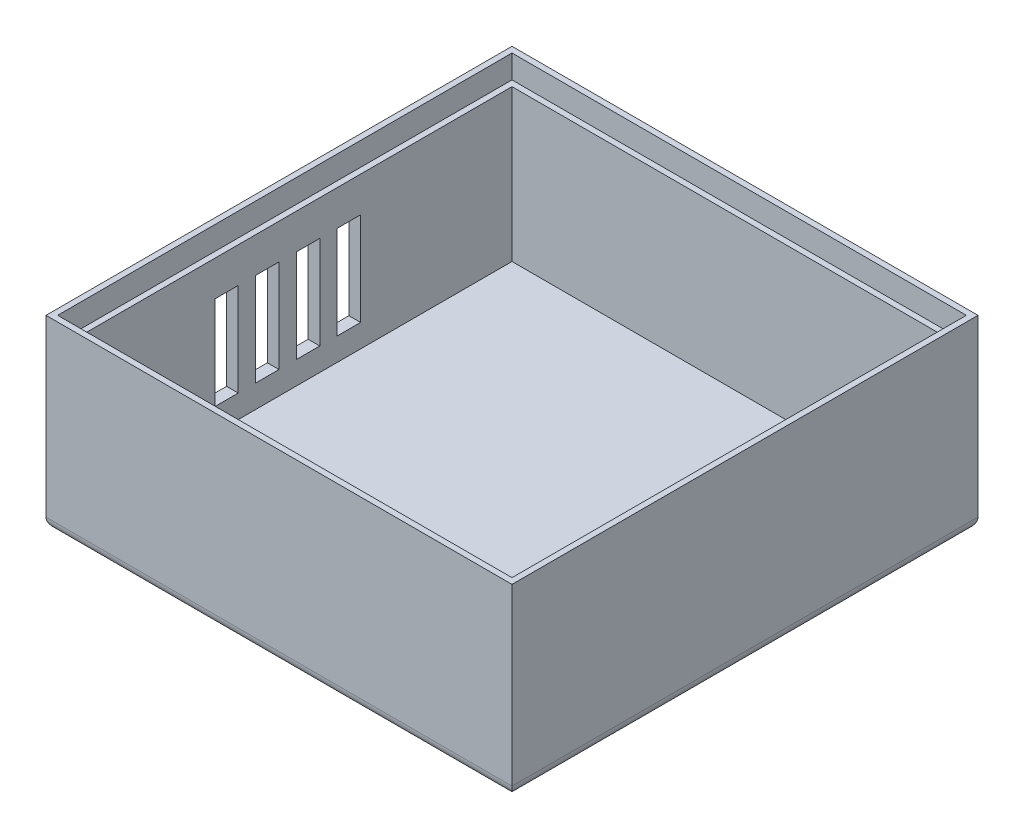
from build123d import *

# Parameters (mm, degrees)
SKETCH_1_W          = 40
SKETCH_1_H          = 40
EXTRUDE_1_DEPTH     = 16
SKETCH_2_W          = 38
SKETCH_2_H          = 38
CUT_EXTRUDE_2_DEPTH = 15
FILLET_2_R          = 1
SKETCH_5_W          = 38
SKETCH_5_H          = 2
CUT_EXTRUDE_4_DEPTH = 0.5
SKETCH_6_W          = 38.5
SKETCH_6_H          = 2
CUT_EXTRUDE_5_DEPTH = 0.5
SKETCH_7_W          = 38.5
SKETCH_7_H          = 2
CUT_EXTRUDE_6_DEPTH = 0.5
SKETCH_8_W          = 39
SKETCH_8_H          = 2
CUT_EXTRUDE_7_DEPTH = 0.5
SKETCH_9_W          = 2
SKETCH_9_H          = 8
CUT_EXTRUDE_9_DEPTH = 10


with BuildPart() as part:
    # Эскиз1 → Бобышка-Вытянуть1 (new body)
    with BuildSketch(Plane(origin=(0, 0, 0), x_dir=(1, 0, 0), z_dir=(0, 1, 0))):
        with Locations((18.915, -19.461)):
            Rectangle(SKETCH_1_W, SKETCH_1_H)
    extrude(amount=EXTRUDE_1_DEPTH)

    # Эскиз2 → Вырез-Вытянуть2 (cut)
    with BuildSketch(Plane(origin=(0, 16, 0), x_dir=(1, 0, 0), z_dir=(0, 1, 0))):
        with Locations((18.915, -19.461)):
            Rectangle(SKETCH_2_W, SKETCH_2_H)
    extrude(amount=-CUT_EXTRUDE_2_DEPTH, mode=Mode.SUBTRACT)

    # Скругление2
    fillet_2_edges = [part.edges().sort_by_distance(p)[0] for p in [
        (18.915, 0, -0.539),
        (38.915, 0, 19.461),
        (18.915, 0, 39.461),
        (-1.085, 0, 19.461),
    ]]
    fillet(fillet_2_edges, radius=FILLET_2_R)

    # Эскиз5 → Вырез-Вытянуть4 (cut)
    with BuildSketch(Plane(origin=(0, 0, 38.461), x_dir=(-1, 0, 0), z_dir=(0, 0, -1))):
        with Locations((-18.915, 15)):
            Rectangle(SKETCH_5_W, SKETCH_5_H)
    extrude(amount=-CUT_EXTRUDE_4_DEPTH, mode=Mode.SUBTRACT)

    # Эскиз6 → Вырез-Вытянуть5 (cut)
    with BuildSketch(Plane(origin=(-0.085, 0, 0), x_dir=(0, 0, -1), z_dir=(1, 0, 0))):
        with Locations((-19.711, 15)):
            Rectangle(SKETCH_6_W, SKETCH_6_H)
    extrude(amount=-CUT_EXTRUDE_5_DEPTH, mode=Mode.SUBTRACT)

    # Эскиз7 → Вырез-Вытянуть6 (cut)
    with BuildSketch(Plane.XY.offset(0.461)):
        with Locations((18.665, 15)):
            Rectangle(SKETCH_7_W, SKETCH_7_H)
    extrude(amount=-CUT_EXTRUDE_6_DEPTH, mode=Mode.SUBTRACT)

    # Эскиз8 → Вырез-Вытянуть7 (cut)
    with BuildSketch(Plane.ZY.offset(-37.915)):
        with Locations((19.461, 15)):
            Rectangle(SKETCH_8_W, SKETCH_8_H)
    extrude(amount=-CUT_EXTRUDE_7_DEPTH, mode=Mode.SUBTRACT)

    # Эскиз9 → Вырез-Вытянуть9 (cut)
    with BuildSketch(Plane.ZY.offset(1.085)):
        with Locations((17.961, 6.970991383)):
            Rectangle(SKETCH_9_W, SKETCH_9_H)
        with Locations((14.461, 6.970991383)):
            Rectangle(SKETCH_9_W, SKETCH_9_H)
        with Locations((21.461, 6.970991383)):
            Rectangle(SKETCH_9_W, SKETCH_9_H)
        with Locations((24.961, 6.970991383)):
            Rectangle(SKETCH_9_W, SKETCH_9_H)
    extrude(amount=-CUT_EXTRUDE_9_DEPTH, mode=Mode.SUBTRACT)


solid = part.part
